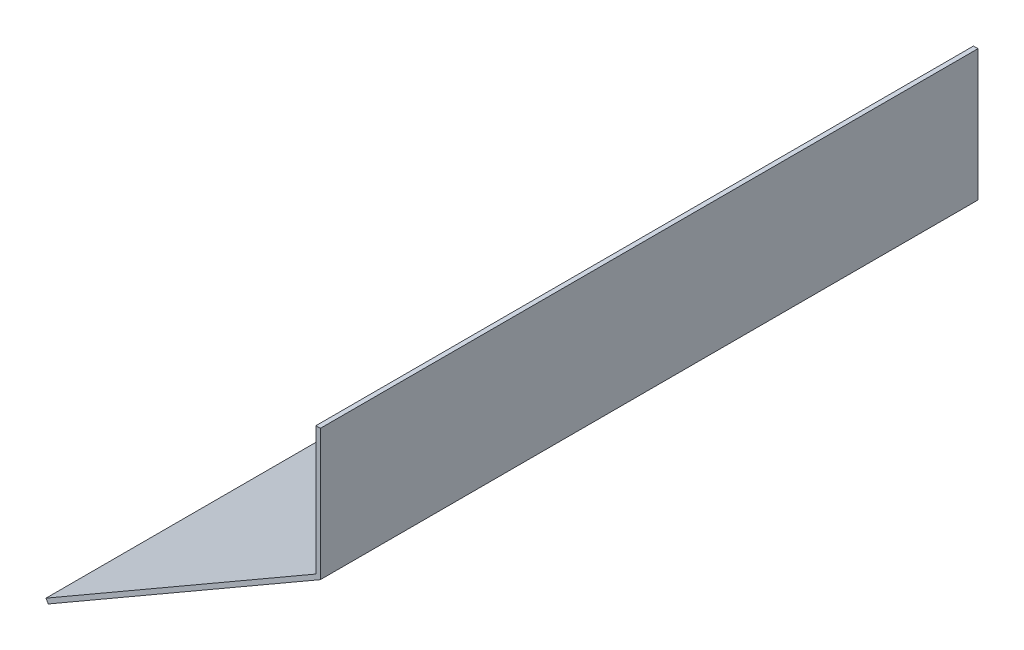
from build123d import *

# Parameters (mm, degrees)
BOSS_EXTRUDE1_DEPTH = 290


with BuildPart() as part:
    # Sketch1 → Boss-Extrude1 (new body)
    with BuildSketch(Plane.XY):
        Polygon((-65.716780924, -44.402682563), (53.283219076, 24.30199947), (53.283219076, 80.954456036), (55.283219076, 80.954456036), (55.283219076, 23.147298932), (-64.716780924, -46.134733371), align=None)
    extrude(amount=BOSS_EXTRUDE1_DEPTH)


solid = part.part
